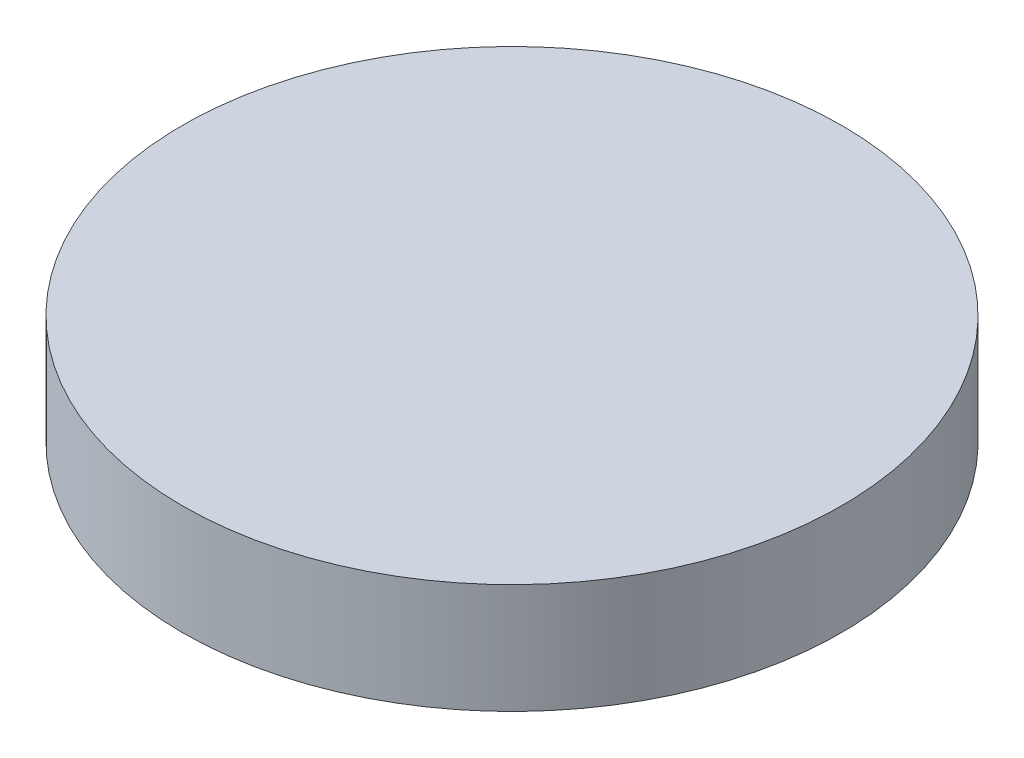
from build123d import *

# Parameters (mm, degrees)
SKETCH1_R           = 1.5
BOSS_EXTRUDE1_DEPTH = 0.5


with BuildPart() as part:
    # Sketch1 → Boss-Extrude1 (new body)
    with BuildSketch(Plane(origin=(0, 0, 0), x_dir=(1, 0, 0), z_dir=(0, 1, 0))):
        with Locations(Location((0, 0, 0), (0, 0, 270))):
            Circle(SKETCH1_R)
    extrude(amount=BOSS_EXTRUDE1_DEPTH)


solid = part.part
